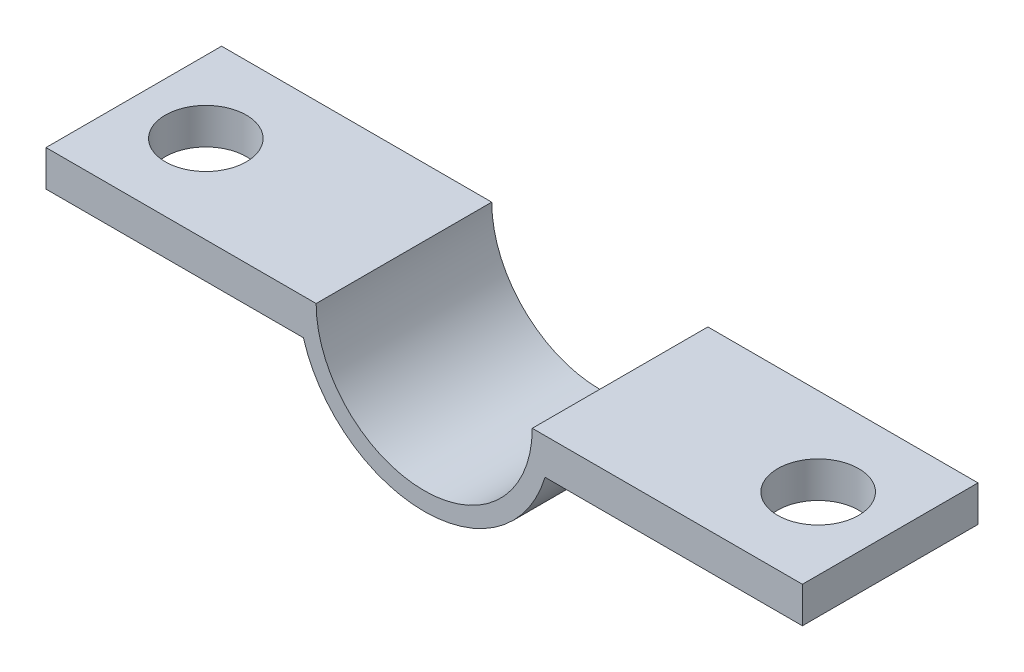
from build123d import *

# Parameters (mm, degrees)
EXTRUDE_THIN1_DEPTH = 9.75
SKETCH3_W           = 15
SKETCH3_H           = 9.75
BOSS_EXTRUDE1_DEPTH = 2
SKETCH4_R           = 2.25
CUT_EXTRUDE1_DEPTH  = 25.188065239


with BuildPart() as part:
    # Sketch1 → Extrude-Thin1 (new body)
    with BuildSketch(Plane.XY):
        with BuildLine():
            ThreePointArc((-6, 0), (0, -6), (6, 0))
            Line((6, 0), (7, 0))
            ThreePointArc((7, 0), (0, -7), (-7, 0))
            Line((-7, 0), (-6, 0))
        make_face()
    extrude(amount=EXTRUDE_THIN1_DEPTH)

    # Sketch3 → Boss-Extrude1 (add)
    with BuildSketch(Plane(origin=(0, 0, 0), x_dir=(1, 0, 0), z_dir=(0, 1, 0))):
        with Locations((-13.5, -4.875)):
            Rectangle(SKETCH3_W, SKETCH3_H)
        with Locations((13.5, -4.875)):
            Rectangle(SKETCH3_W, SKETCH3_H)
    extrude(amount=-BOSS_EXTRUDE1_DEPTH)

    # Sketch4 → Cut-Extrude1 (cut, through all)
    with BuildSketch(Plane(origin=(0, 0, 0), x_dir=(1, 0, 0), z_dir=(0, 1, 0))):
        with Locations(Location((-17, -4.875, 0), (0, 0, 180))):
            Circle(SKETCH4_R)
        with Locations((17, -4.875)):
            Circle(SKETCH4_R)
    extrude(amount=-CUT_EXTRUDE1_DEPTH, mode=Mode.SUBTRACT)


solid = part.part
